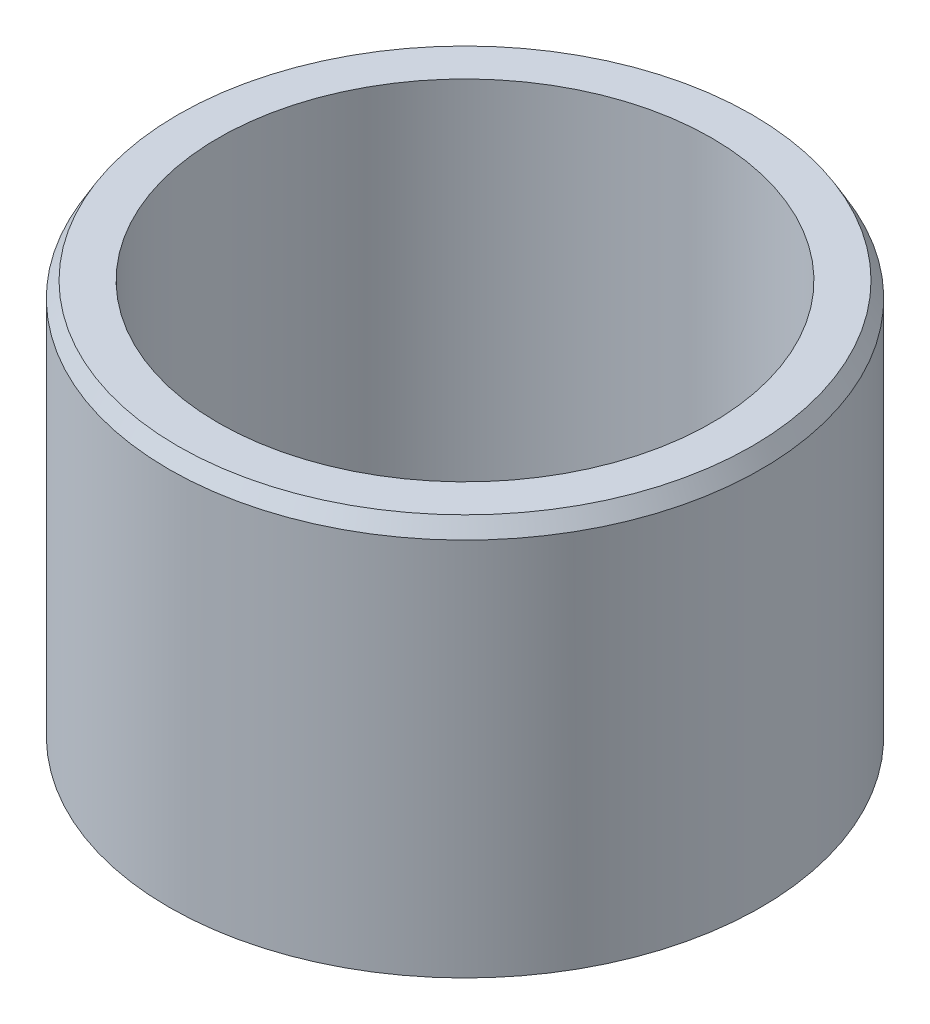
from build123d import *

# Parameters (mm, degrees)
SKETCH1_W      = 1.5875
SKETCH1_H      = 12.7
CHAMFER1_SIZE  = 0.50038
CHAMFER1_SIZE2 = 0.288894528


with BuildPart() as part:
    # Sketch1 → Revolve1 (revolve)
    with BuildSketch(Plane.XY, mode=Mode.PRIVATE) as revolve1_sk:
        with Locations((8.73125, 6.35)):
            Rectangle(SKETCH1_W, SKETCH1_H)
    revolve(revolve1_sk.sketch.rotate(Axis((0, 21.439877717, 0), (0, -1, 0)), 90), axis=Axis((0, 21.439877717, 0), (0, -1, 0)))

    # Chamfer1
    chamfer1_edges = [part.edges().sort_by_distance(p)[0] for p in [
        (0, 12.7, -9.525),
    ]]
    chamfer1_side = [part.faces().sort_by_distance(p)[0] for p in [
        (0, 6.35, -9.525),
    ]]
    chamfer(chamfer1_edges, length=CHAMFER1_SIZE, length2=CHAMFER1_SIZE2, reference=chamfer1_side[0])


solid = part.part
